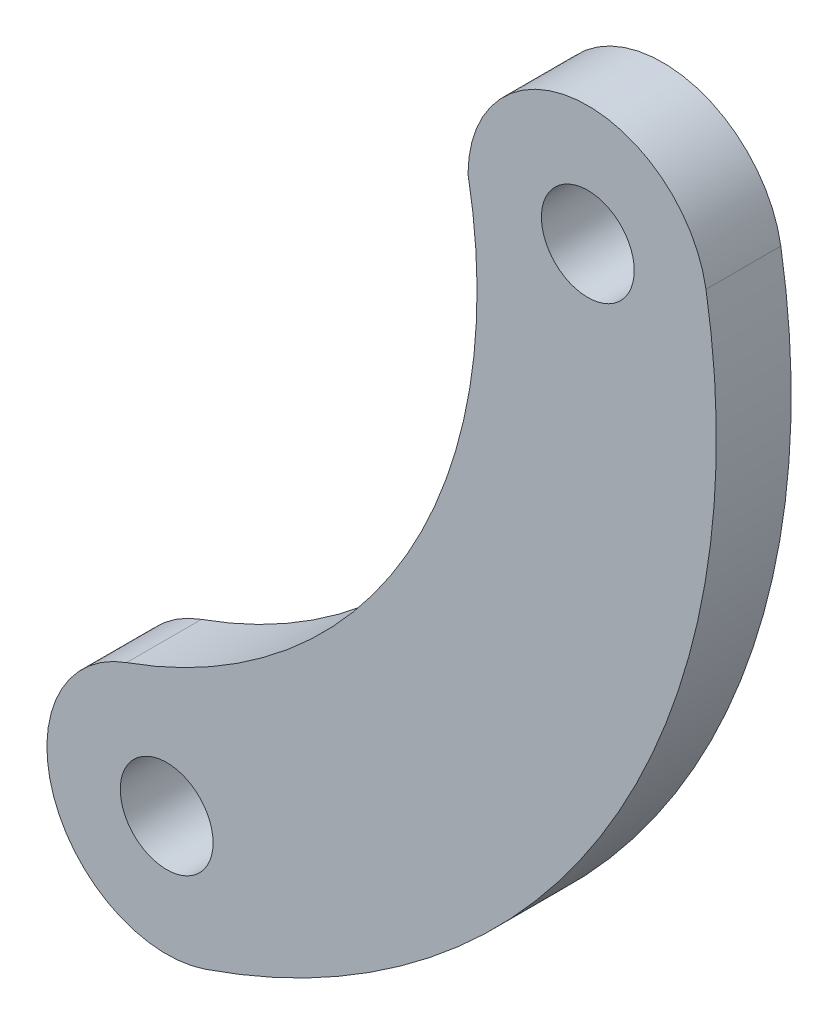
from build123d import *

# Parameters (mm, degrees)
SKETCH_1_R      = 1.55
EXTRUDE_1_DEPTH = 2.5


with BuildPart() as part:
    # 草图1 → 凸台-拉伸1 (new body)
    with BuildSketch(Plane.XY):
        with BuildLine():
            ThreePointArc((3.788209298, -5.131231863), (1.749021423, -17.157010835), (-7.616568772, -24.971316137))
            ThreePointArc((-7.616568772, -24.971316137), (-10.053734836, -30.056855863), (-4.983429041, -32.525558333))
            ThreePointArc((-4.983429041, -32.525558333), (8.522703471, -21.579947988), (11.737320259, -4.495210935))
            ThreePointArc((11.737320259, -4.495210935), (7.471006419, -1.166769732), (3.788209298, -5.131231863))
        make_face()
        with Locations((7.790197951, -5.156086427)):
            Circle(SKETCH_1_R, mode=Mode.SUBTRACT)
        with Locations((-6.276540895, -28.740260607)):
            Circle(SKETCH_1_R, mode=Mode.SUBTRACT)
    extrude(amount=EXTRUDE_1_DEPTH)


solid = part.part
